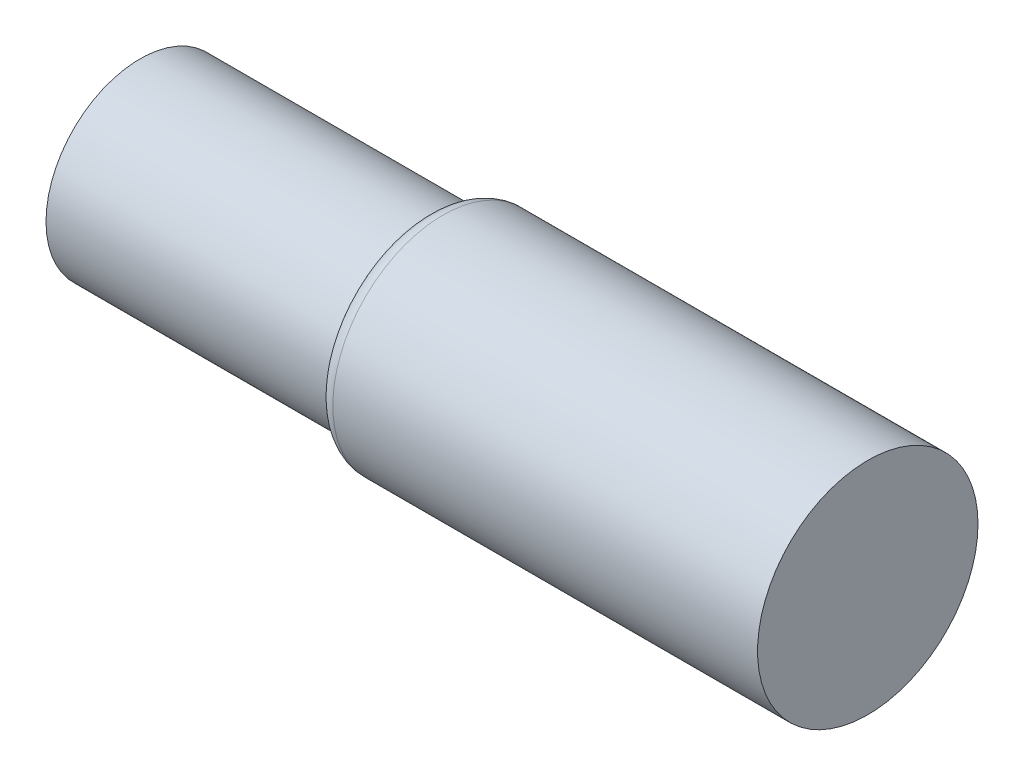
from build123d import *

# Parameters (mm, degrees)
SKETCH2_R           = 16
BOSS_EXTRUDE1_DEPTH = 48.8
SKETCH3_R           = 18.75
BOSS_EXTRUDE2_DEPTH = 75
FILLET1_R           = 2.74
SKETCH4_R           = 3
CUT_EXTRUDE1_DEPTH  = 2
SKETCH5_R           = 2
CUT_EXTRUDE2_DEPTH  = 10


with BuildPart() as part:
    # Sketch2 → Boss-Extrude1 (new body)
    with BuildSketch(Plane(origin=(0, 0, 0), x_dir=(0, 0, -1), z_dir=(1, 0, 0))):
        Circle(SKETCH2_R)
    extrude(amount=BOSS_EXTRUDE1_DEPTH)

    # Sketch3 → Boss-Extrude2 (add)
    with BuildSketch(Plane(origin=(48.8, 0, 0), x_dir=(0, 0, -1), z_dir=(1, 0, 0))):
        Circle(SKETCH3_R)
    extrude(amount=BOSS_EXTRUDE2_DEPTH)

    # Fillet1
    fillet1_edges = [part.edges().sort_by_distance(p)[0] for p in [
        (48.8, 0, 18.75),
    ]]
    fillet(fillet1_edges, radius=FILLET1_R)

    # Sketch4 → Cut-Extrude1 (cut)
    with BuildSketch(Plane.ZY):
        Circle(SKETCH4_R)
    extrude(amount=-CUT_EXTRUDE1_DEPTH, mode=Mode.SUBTRACT)

    # Sketch5 → Cut-Extrude2 (cut)
    with BuildSketch(Plane.ZY):
        with Locations((-8, 8)):
            Circle(SKETCH5_R)
        with Locations(Location((8, 8, 0), (0, 0, 180))):
            Circle(SKETCH5_R)
        with Locations((8, -8)):
            Circle(SKETCH5_R)
        with Locations(Location((-8, -8, 0), (0, 0, 180))):
            Circle(SKETCH5_R)
    extrude(amount=-CUT_EXTRUDE2_DEPTH, mode=Mode.SUBTRACT)


solid = part.part
